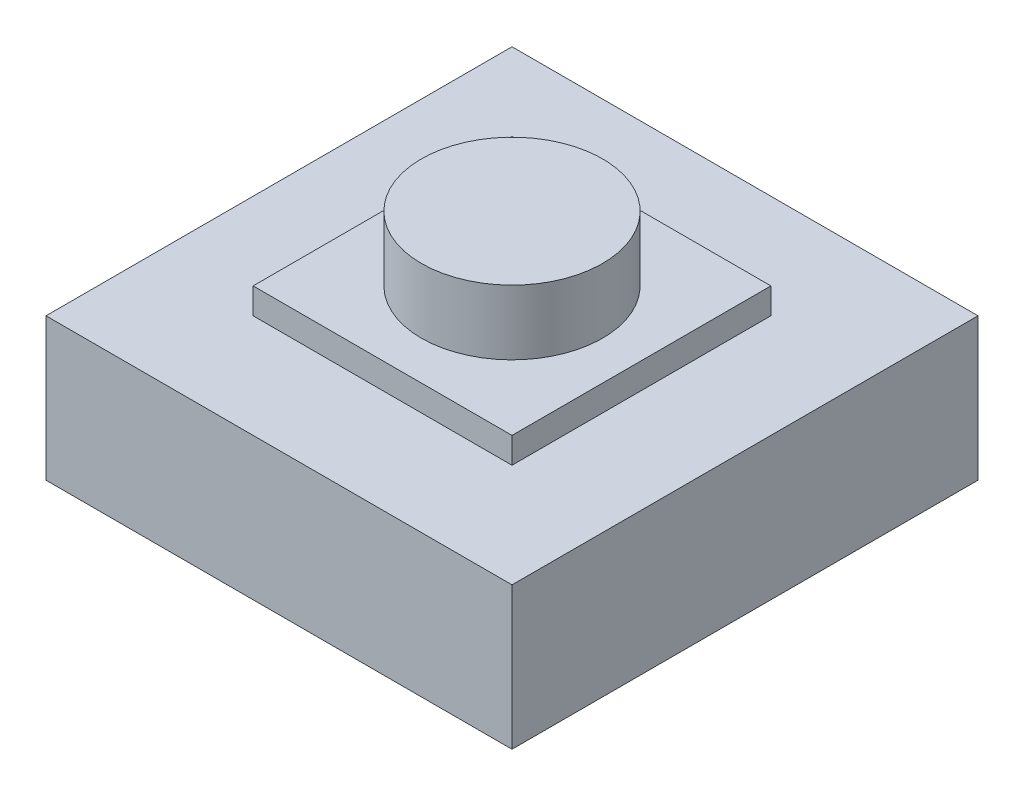
from build123d import *

# Parameters (mm, degrees)
SKETCH_1_W      = 36
SKETCH_1_H      = 36
EXTRUDE_1_DEPTH = 11
SKETCH_2_W      = 20
SKETCH_2_H      = 20
EXTRUDE_2_DEPTH = 2
SKETCH_4_R      = 7
EXTRUDE_4_DEPTH = 5


with BuildPart() as part:
    # 草图1 → 凸台-拉伸1 (new body)
    with BuildSketch(Plane(origin=(0, 0, 0), x_dir=(1, 0, 0), z_dir=(0, 1, 0))):
        Rectangle(SKETCH_1_W, SKETCH_1_H)
    extrude(amount=EXTRUDE_1_DEPTH)

    # 草图2 → 凸台-拉伸2 (add)
    with BuildSketch(Plane(origin=(0, 11, 0), x_dir=(1, 0, 0), z_dir=(0, 1, 0))):
        Rectangle(SKETCH_2_W, SKETCH_2_H)
    extrude(amount=EXTRUDE_2_DEPTH)

    # 草图4 → 凸台-拉伸4 (add)
    with BuildSketch(Plane(origin=(0, 13, 0), x_dir=(1, 0, 0), z_dir=(0, 1, 0))):
        with Locations(Location((0, 0, 0), (0, 0, 270))):
            Circle(SKETCH_4_R)
    extrude(amount=EXTRUDE_4_DEPTH)


solid = part.part
